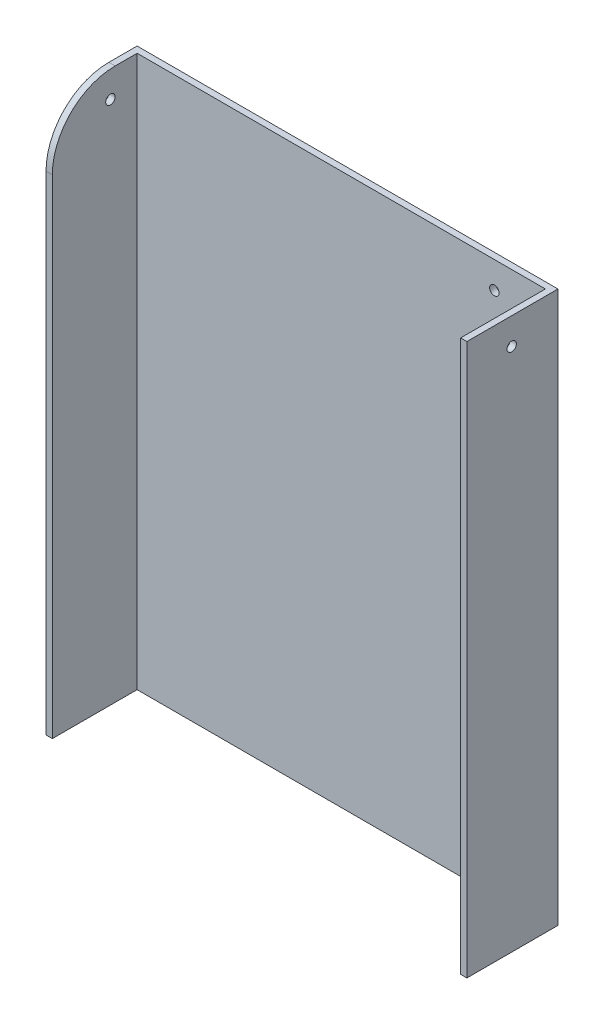
from build123d import *

# Parameters (mm, degrees)
SKETCH1_W           = 130
SKETCH1_H           = 175.5
BOSS_EXTRUDE1_DEPTH = 2
SKETCH2_W           = 29
SKETCH2_H           = 175.5
BOSS_EXTRUDE2_DEPTH = 2
SKETCH3_W           = 29
SKETCH3_H           = 175.5
BOSS_EXTRUDE3_DEPTH = 2
SKETCH4_W           = 10
SKETCH4_H           = 5
CUT_EXTRUDE1_DEPTH  = 4
FILLET1_R           = 20
FILLET2_R           = 1
SKETCH5_R           = 1.5
CUT_EXTRUDE2_DEPTH  = 2
SKETCH6_R           = 1.5
CUT_EXTRUDE3_DEPTH  = 2
SKETCH7_R           = 1.5
CUT_EXTRUDE4_DEPTH  = 2


with BuildPart() as part:
    # Sketch1 → Boss-Extrude1 (new body)
    with BuildSketch(Plane.XY):
        with Locations((65, 87.75)):
            Rectangle(SKETCH1_W, SKETCH1_H)
    extrude(amount=BOSS_EXTRUDE1_DEPTH)

    # Sketch2 → Boss-Extrude2 (add)
    with BuildSketch(Plane(origin=(130, 0, 0), x_dir=(0, 0, -1), z_dir=(1, 0, 0))):
        with Locations((-14.5, 87.75)):
            Rectangle(SKETCH2_W, SKETCH2_H)
    extrude(amount=BOSS_EXTRUDE2_DEPTH)

    # Sketch3 → Boss-Extrude3 (add)
    with BuildSketch(Plane.ZY):
        with Locations((14.5, 87.75)):
            Rectangle(SKETCH3_W, SKETCH3_H)
    extrude(amount=BOSS_EXTRUDE3_DEPTH)

    # Sketch4 → Cut-Extrude1 (cut)
    with BuildSketch(Plane.XY.offset(2)):
        with Locations((120.332257012, 2.5)):
            Rectangle(SKETCH4_W, SKETCH4_H)
    extrude(amount=-CUT_EXTRUDE1_DEPTH, mode=Mode.SUBTRACT)

    # Fillet1
    fillet1_edges = [part.edges().sort_by_distance(p)[0] for p in [
        (-1, 175.5, 29),
    ]]
    fillet(fillet1_edges, radius=FILLET1_R)

    # Fillet2
    fillet2_edges = [part.edges().sort_by_distance(p)[0] for p in [
        (115.332257012, 5, 1),
        (125.332257012, 5, 1),
    ]]
    fillet(fillet2_edges, radius=FILLET2_R)

    # Sketch5 → Cut-Extrude2 (cut)
    with BuildSketch(Plane.ZY.offset(-130)):
        with Locations((14.73, 167)):
            Circle(SKETCH5_R)
    extrude(amount=-CUT_EXTRUDE2_DEPTH, mode=Mode.SUBTRACT)

    # Sketch6 → Cut-Extrude3 (cut)
    with BuildSketch(Plane.XY.offset(2)):
        with Locations((113.75, 167)):
            Circle(SKETCH6_R)
    extrude(amount=-CUT_EXTRUDE3_DEPTH, mode=Mode.SUBTRACT)

    # Sketch7 → Cut-Extrude4 (cut)
    with BuildSketch(Plane(origin=(0, 0, 0), x_dir=(0, 0, -1), z_dir=(1, 0, 0))):
        with Locations((-10.5, 167)):
            Circle(SKETCH7_R)
    extrude(amount=-CUT_EXTRUDE4_DEPTH, mode=Mode.SUBTRACT)


solid = part.part
